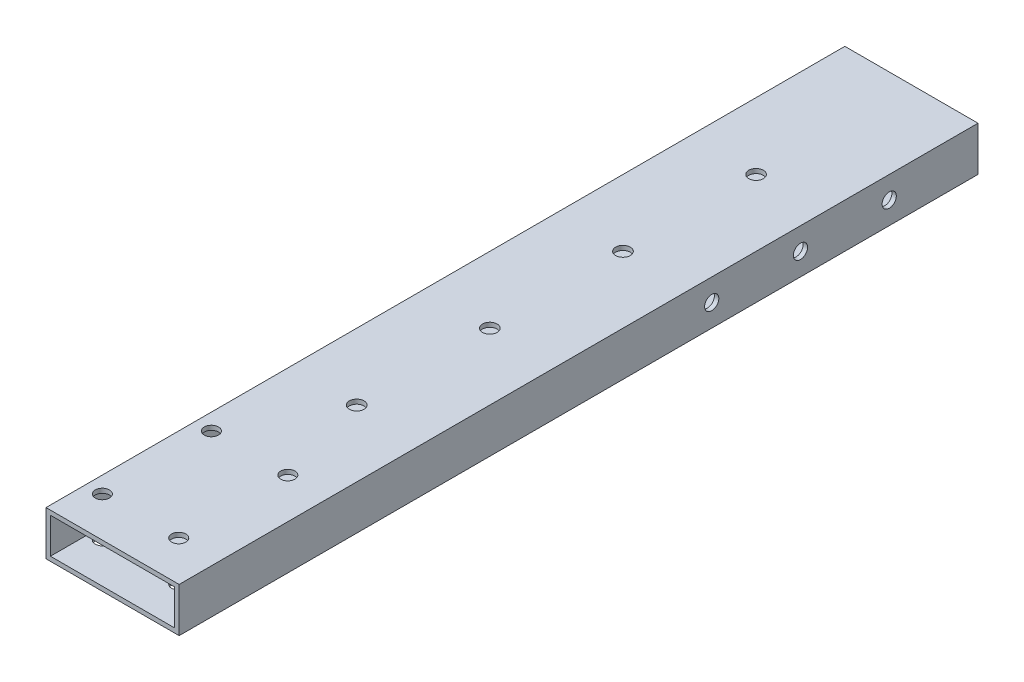
from build123d import *

# Parameters (mm, degrees)
SKETCH_1_W          = 30
SKETCH_1_H          = 10
SKETCH_1_W_2        = 26
SKETCH_1_H_2        = 6
EXTRUDE_1_DEPTH     = 330
SKETCH_2_R          = 1.6
CUT_EXTRUDE_1_DEPTH = 331.492057393
SKETCH_3_R          = 1.6
SKETCH_3_R_2        = 1.65
CUT_EXTRUDE_2_DEPTH = 331.492057393
SKETCH_4_R          = 1.6
CUT_EXTRUDE_3_DEPTH = 332.398551596
SKETCH_6_W          = 28
SKETCH_6_H          = 8
CUT_EXTRUDE_5_DEPTH = 355
SKETCH_7_R          = 1.6
CUT_EXTRUDE_6_DEPTH = 14
SKETCH_9_W          = 30
SKETCH_9_H          = 10
CUT_EXTRUDE_7_DEPTH = 150


with BuildPart() as part:
    # 草图1 → 凸台-拉伸1 (new body)
    with BuildSketch(Plane.XY):
        Rectangle(SKETCH_1_W, SKETCH_1_H)
        Rectangle(SKETCH_1_W_2, SKETCH_1_H_2, mode=Mode.SUBTRACT)
    extrude(amount=EXTRUDE_1_DEPTH)

    # 草图2 → 切除-拉伸1 (cut, through all)
    with BuildSketch(Plane(origin=(0, 5, 0), x_dir=(1, 0, 0), z_dir=(0, 1, 0))):
        with Locations(Location((-11.3, -321, 0), (0, 0, 270))):
            Circle(SKETCH_2_R)
    extrude(amount=-CUT_EXTRUDE_1_DEPTH, mode=Mode.SUBTRACT)

    # 草图3 → 切除-拉伸2 (cut, through all)
    with BuildSketch(Plane(origin=(0, 5, 0), x_dir=(1, 0, 0), z_dir=(0, 1, 0))):
        with Locations(Location((5.907293091, -296.425438671, 0), (0, 0, 270))):
            Circle(SKETCH_3_R)
        with Locations(Location((0, -215, 0), (0, 0, 270))):
            Circle(SKETCH_3_R_2)
        with Locations(Location((0, -185, 0), (0, 0, 270))):
            Circle(SKETCH_3_R_2)
        with Locations(Location((0, -275, 0), (0, 0, 270))):
            Circle(SKETCH_3_R_2)
        with Locations(Location((0, -245, 0), (0, 0, 270))):
            Circle(SKETCH_3_R_2)
    extrude(amount=-CUT_EXTRUDE_2_DEPTH, mode=Mode.SUBTRACT)

    # 草图4 → 切除-拉伸3 (cut, through all)
    with BuildSketch(Plane.ZY.offset(15)):
        with Locations((170, 0)):
            Circle(SKETCH_4_R)
        with Locations((190, 0)):
            Circle(SKETCH_4_R)
        with Locations((210, 0)):
            Circle(SKETCH_4_R)
    extrude(amount=-CUT_EXTRUDE_3_DEPTH, mode=Mode.SUBTRACT)

    # 草图6 → 切除-拉伸5 (cut)
    with BuildSketch(Plane(origin=(0, 0, 0), x_dir=(-1, 0, 0), z_dir=(0, 0, -1))):
        Rectangle(SKETCH_6_W, SKETCH_6_H)
    extrude(amount=-CUT_EXTRUDE_5_DEPTH, mode=Mode.SUBTRACT)

    # 草图7 → 切除-拉伸6 (cut)
    with BuildSketch(Plane(origin=(0, 5, 0), x_dir=(1, 0, 0), z_dir=(0, 1, 0))):
        with Locations(Location((5.907293091, -321, 0), (0, 0, 270))):
            Circle(SKETCH_7_R)
        with Locations(Location((-11.3, -296.425438671, 0), (0, 0, 270))):
            Circle(SKETCH_7_R)
    extrude(amount=-CUT_EXTRUDE_6_DEPTH, mode=Mode.SUBTRACT)

    # 草图9 → 切除-拉伸7 (cut)
    with BuildSketch(Plane(origin=(0, 0, 0), x_dir=(-1, 0, 0), z_dir=(0, 0, -1))):
        Rectangle(SKETCH_9_W, SKETCH_9_H)
    extrude(amount=-CUT_EXTRUDE_7_DEPTH, mode=Mode.SUBTRACT)


solid = part.part
